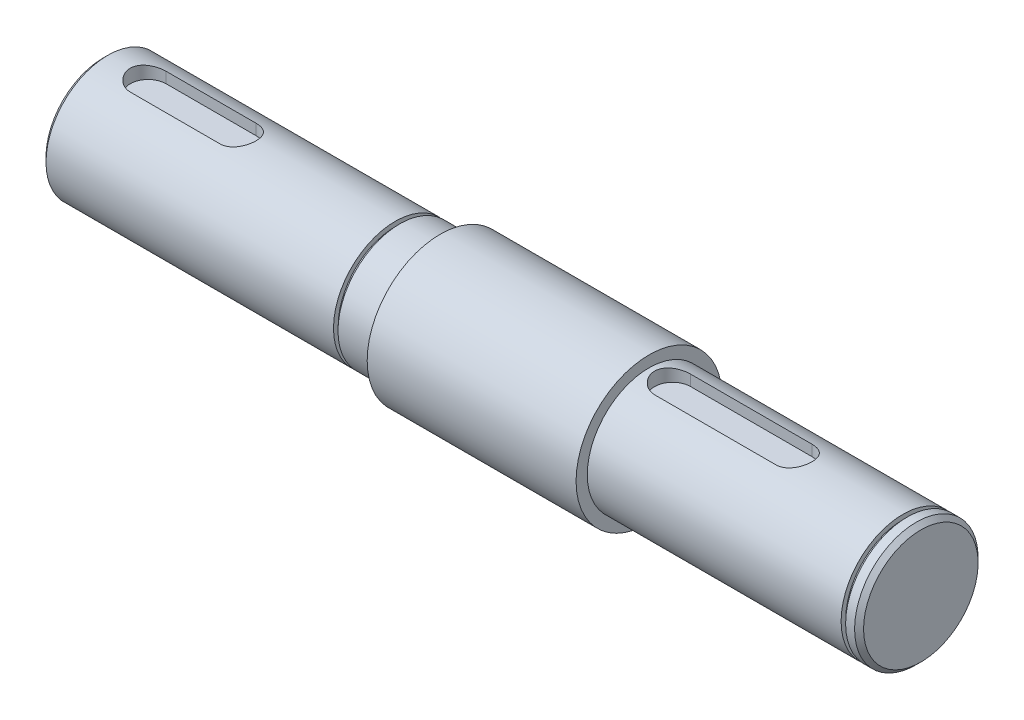
from build123d import *

# Parameters (mm, degrees)
CUT_EXTRUDE1_DEPTH = 6
CUT_EXTRUDE2_DEPTH = 6


with BuildPart() as part:
    # Sketch1 → Revolve1 (revolve)
    with BuildSketch(Plane.XY, mode=Mode.PRIVATE) as revolve1_sk:
        Polygon((0, 0), (364, 0), (364, 25.5), (362, 27.5), (358, 27.5), (358, 25.4), (356, 25.4), (356, 27.5), (243, 27.5), (243, 32.5), (150, 32.5), (150, 27.5), (132, 27.5), (132, 25.4), (130, 25.4), (130, 27.5), (2, 27.5), (0, 25.5), align=None)
    revolve(revolve1_sk.sketch.rotate(Axis((0, 0, 0), (1, 0, 0)), 90), axis=Axis((0, 0, 0), (1, 0, 0)))

    # Sketch2 → Cut-Extrude1 (cut)
    with BuildSketch(Plane(origin=(0, 27.5, 0), x_dir=(1, 0, 0), z_dir=(0, 1, 0))):
        with BuildLine():
            Line((253.5, 8), (307.5, 8))
            ThreePointArc((307.5, 8), (315.5, 0), (307.5, -8))
            Line((307.5, -8), (253.5, -8))
            ThreePointArc((253.5, -8), (245.5, 0), (253.5, 8))
        make_face()
    extrude(amount=-CUT_EXTRUDE1_DEPTH, mode=Mode.SUBTRACT)

    # Sketch3 → Cut-Extrude2 (cut)
    with BuildSketch(Plane(origin=(0, 27.5, 0), x_dir=(1, 0, 0), z_dir=(0, 1, 0))):
        with BuildLine():
            Line((20, 8), (60, 8))
            ThreePointArc((60, 8), (68, 0), (60, -8))
            Line((60, -8), (20, -8))
            ThreePointArc((20, -8), (12, 0), (20, 8))
        make_face()
    extrude(amount=-CUT_EXTRUDE2_DEPTH, mode=Mode.SUBTRACT)


solid = part.part
